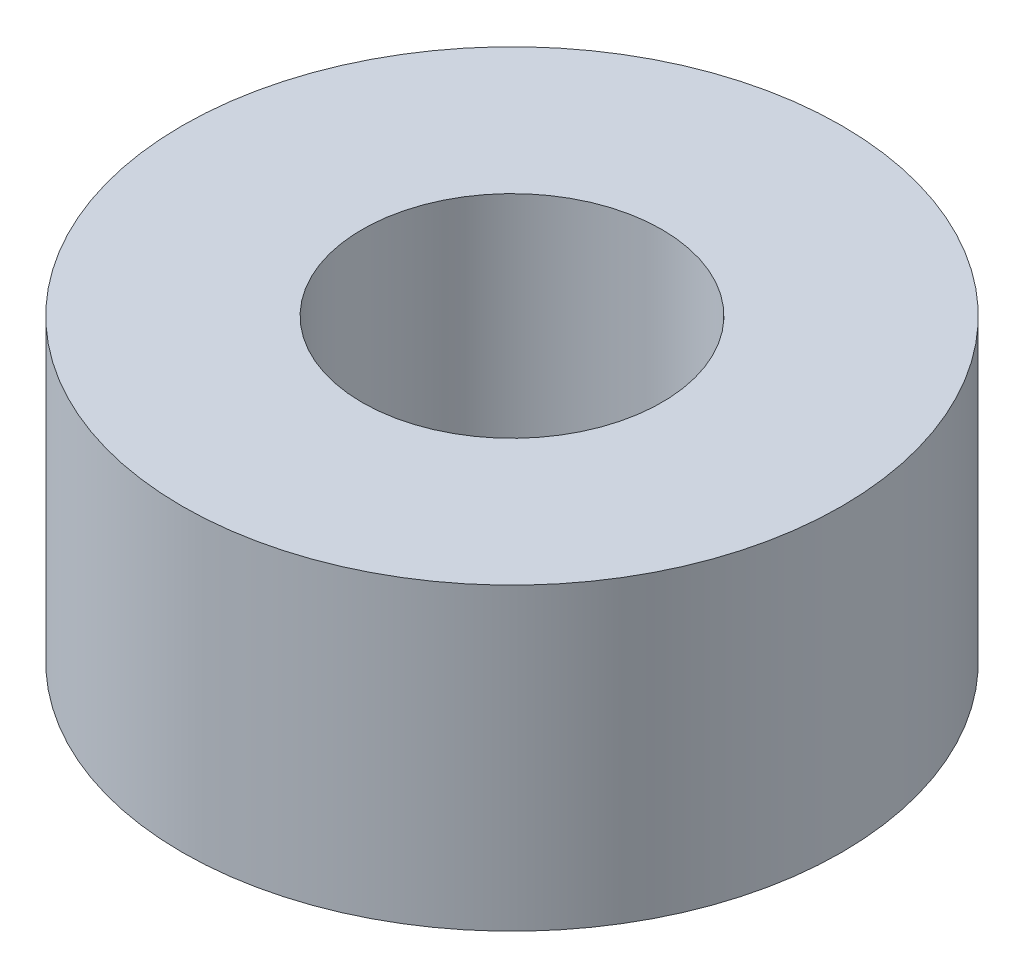
from build123d import *

# Parameters (mm, degrees)
SKETCH1_R           = 5.5
SKETCH1_R_2         = 2.5
BOSS_EXTRUDE1_DEPTH = 5


with BuildPart() as part:
    # Sketch1 → Boss-Extrude1 (new body)
    with BuildSketch(Plane(origin=(0, 0, 0), x_dir=(1, 0, 0), z_dir=(0, 1, 0))):
        with Locations(Location((0, 0, 0), (0, 0, 270))):
            Circle(SKETCH1_R)
        with Locations(Location((0, 0, 0), (0, 0, 270))):
            Circle(SKETCH1_R_2, mode=Mode.SUBTRACT)
    extrude(amount=BOSS_EXTRUDE1_DEPTH)


solid = part.part
